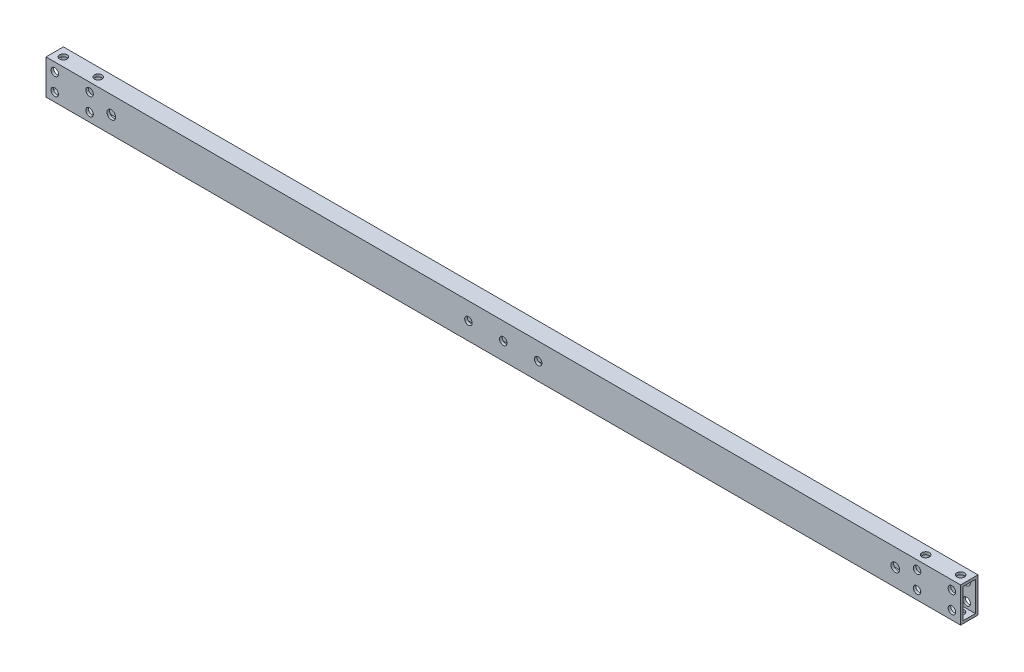
from build123d import *

# Parameters (mm, degrees)
SKETCH_1_W          = 10
SKETCH_1_H          = 20
SKETCH_1_W_2        = 7
SKETCH_1_H_2        = 17
EXTRUDE_1_DEPTH     = 525
SKETCH_2_R          = 2.15
SKETCH_2_R_2        = 2.5
CUT_EXTRUDE_1_DEPTH = 526.19044165
CUT_EXTRUDE_2_REACH = 527.405
SKETCH_3_R          = 2.15


with BuildPart() as part:
    # ｽｹｯﾁ1 → 押し出し-薄板1 (new body)
    with BuildSketch(Plane(origin=(0, 0, 0), x_dir=(0, 0, -1), z_dir=(1, 0, 0))):
        Rectangle(SKETCH_1_W, SKETCH_1_H)
        Rectangle(SKETCH_1_W_2, SKETCH_1_H_2, mode=Mode.SUBTRACT)
    extrude(amount=EXTRUDE_1_DEPTH)

    # ｽｹｯﾁ2 → ｶｯﾄ - 押し出し1 (cut, through all)
    with BuildSketch(Plane.XY.offset(5)):
        with Locations((282.5, 0)):
            Circle(SKETCH_2_R)
        with Locations((262.5, 0)):
            Circle(SKETCH_2_R)
        with Locations(Location((242.5, 0, 0), (0, 0, 90))):
            Circle(SKETCH_2_R)
        with Locations((487.5, 0)):
            Circle(SKETCH_2_R_2)
        with Locations(Location((37.5, 0, 0), (0, 0, 90))):
            Circle(SKETCH_2_R_2)
        with Locations((520, 5)):
            Circle(SKETCH_2_R)
        with Locations(Location((520, -5, 0), (0, 0, 90))):
            Circle(SKETCH_2_R)
        with Locations((500, 5)):
            Circle(SKETCH_2_R)
        with Locations(Location((500, -5, 0), (0, 0, 90))):
            Circle(SKETCH_2_R)
        with Locations((25, -5)):
            Circle(SKETCH_2_R)
        with Locations(Location((25, 5, 0), (0, 0, 90))):
            Circle(SKETCH_2_R)
        with Locations((5, -5)):
            Circle(SKETCH_2_R)
        with Locations(Location((5, 5, 0), (0, 0, 90))):
            Circle(SKETCH_2_R)
    extrude(amount=-CUT_EXTRUDE_1_DEPTH, mode=Mode.SUBTRACT)

    # ｶｯﾄ - 押し出し2: up to this face of the body (flat: up to its plane)
    cut_extrude_2_end = Plane(part.part.faces().sort_by_distance((262.5, -10, 0))[0])
    # ｽｹｯﾁ3 → ｶｯﾄ - 押し出し2 (cut, up to the picked face)
    with BuildSketch(Plane(origin=(0, 10, 0), x_dir=(1, 0, 0), z_dir=(0, 1, 0)), mode=Mode.PRIVATE) as cut_extrude_2_sk1:
        with Locations(Location((5, 0, 0), (0, 0, 270))):
            Circle(SKETCH_3_R)
    cut_extrude_2_tool1 = split(extrude(cut_extrude_2_sk1.sketch, amount=-CUT_EXTRUDE_2_REACH, mode=Mode.PRIVATE), bisect_by=cut_extrude_2_end, keep=Keep.BOTH, mode=Mode.PRIVATE)
    # ｽｹｯﾁ3 → ｶｯﾄ - 押し出し2 (cut, up to the picked face)
    with BuildSketch(Plane(origin=(0, 10, 0), x_dir=(1, 0, 0), z_dir=(0, 1, 0)), mode=Mode.PRIVATE) as cut_extrude_2_sk2:
        with Locations(Location((25, 0, 0), (0, 0, 270))):
            Circle(SKETCH_3_R)
    cut_extrude_2_tool2 = split(extrude(cut_extrude_2_sk2.sketch, amount=-CUT_EXTRUDE_2_REACH, mode=Mode.PRIVATE), bisect_by=cut_extrude_2_end, keep=Keep.BOTH, mode=Mode.PRIVATE)
    # ｽｹｯﾁ3 → ｶｯﾄ - 押し出し2 (cut, up to the picked face)
    with BuildSketch(Plane(origin=(0, 10, 0), x_dir=(1, 0, 0), z_dir=(0, 1, 0)), mode=Mode.PRIVATE) as cut_extrude_2_sk3:
        with Locations(Location((500, 0, 0), (0, 0, 270))):
            Circle(SKETCH_3_R)
    cut_extrude_2_tool3 = split(extrude(cut_extrude_2_sk3.sketch, amount=-CUT_EXTRUDE_2_REACH, mode=Mode.PRIVATE), bisect_by=cut_extrude_2_end, keep=Keep.BOTH, mode=Mode.PRIVATE)
    # ｽｹｯﾁ3 → ｶｯﾄ - 押し出し2 (cut, up to the picked face)
    with BuildSketch(Plane(origin=(0, 10, 0), x_dir=(1, 0, 0), z_dir=(0, 1, 0)), mode=Mode.PRIVATE) as cut_extrude_2_sk4:
        with Locations(Location((520, 0, 0), (0, 0, 270))):
            Circle(SKETCH_3_R)
    cut_extrude_2_tool4 = split(extrude(cut_extrude_2_sk4.sketch, amount=-CUT_EXTRUDE_2_REACH, mode=Mode.PRIVATE), bisect_by=cut_extrude_2_end, keep=Keep.BOTH, mode=Mode.PRIVATE)
    add(cut_extrude_2_tool1.solids().sort_by(Axis((5, 10, 0), (0, -1, 0)))[0], mode=Mode.SUBTRACT)
    add(cut_extrude_2_tool2.solids().sort_by(Axis((25, 10, 0), (0, -1, 0)))[0], mode=Mode.SUBTRACT)
    add(cut_extrude_2_tool3.solids().sort_by(Axis((500, 10, 0), (0, -1, 0)))[0], mode=Mode.SUBTRACT)
    add(cut_extrude_2_tool4.solids().sort_by(Axis((520, 10, 0), (0, -1, 0)))[0], mode=Mode.SUBTRACT)


solid = part.part
